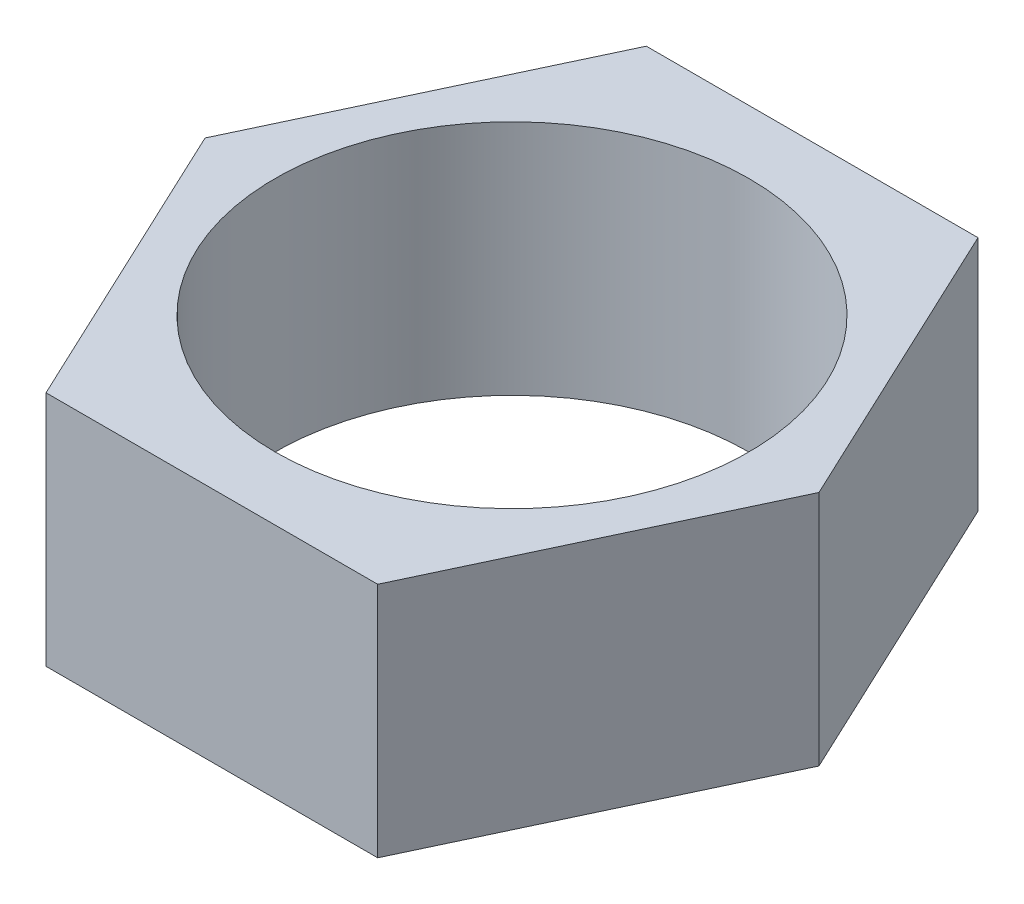
from build123d import *

# Parameters (mm, degrees)
EXTRUDE_1_DEPTH     = 5
CUT_EXTRUDE_1_REACH = 12.349
SKETCH_2_R          = 5


with BuildPart() as part:
    # 草图1 → 凸台-拉伸1 (new body)
    with BuildSketch(Plane(origin=(0, 0, 0), x_dir=(1, 0, 0), z_dir=(0, 1, 0))):
        Polygon((-6.47832956, 0), (6.47832956, 0), (3.5, -6.334789107), (-3.5, -6.334789107), align=None)
        Polygon((-6.47832956, 0), (-3.5, 6.334789107), (3.5, 6.334789107), (6.47832956, 0), align=None)
    extrude(amount=EXTRUDE_1_DEPTH)

    # 草图2 → 切除-拉伸1 (cut, up to next)
    with BuildSketch(Plane(origin=(0, 5, 0), x_dir=(1, 0, 0), z_dir=(0, 1, 0)), mode=Mode.PRIVATE) as cut_extrude_1_sk1:
        with Locations(Location((0, 0, 0), (0, 0, 270))):
            Circle(SKETCH_2_R)
    cut_extrude_1_tool1 = extrude(cut_extrude_1_sk1.sketch, amount=-CUT_EXTRUDE_1_REACH, mode=Mode.PRIVATE) & part.part
    add(cut_extrude_1_tool1.solids().sort_by_distance((0, 5, 0))[0], mode=Mode.SUBTRACT)


solid = part.part
